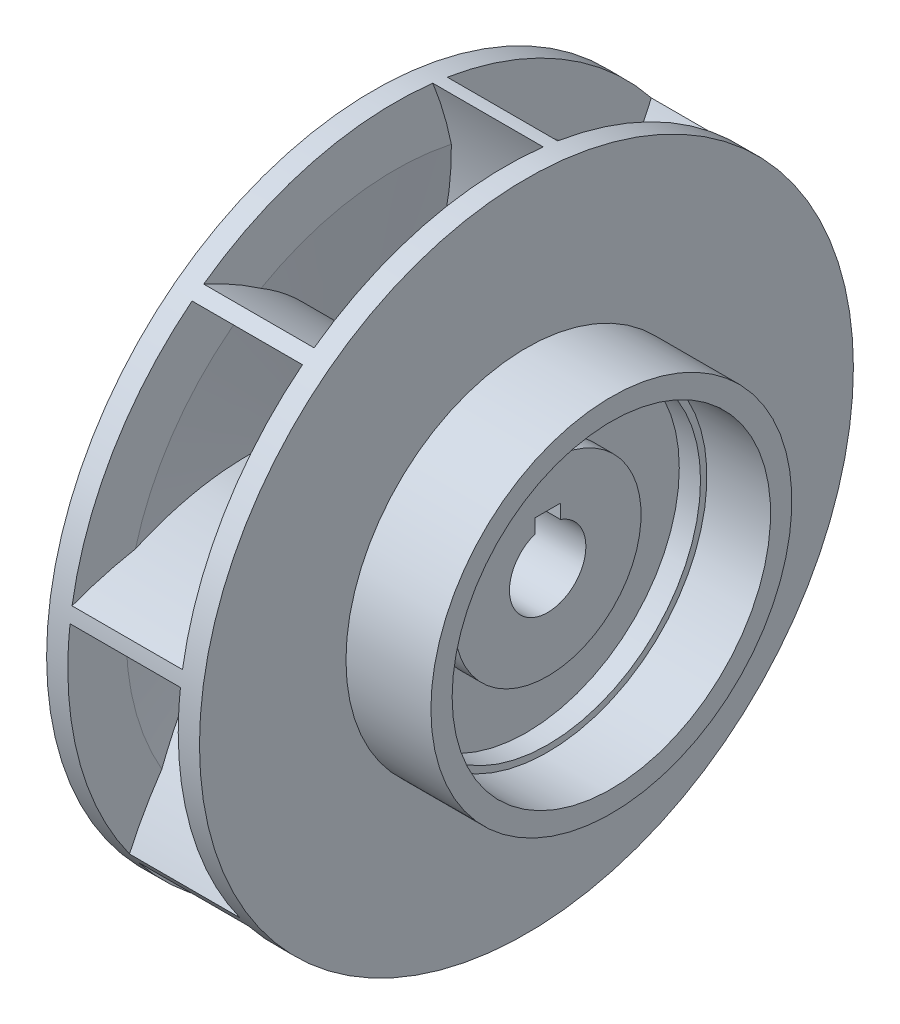
from build123d import *

# Parameters (mm, degrees)
BOSS_EXTRUDE1_START      = 34
BOSS_EXTRUDE1_DEPTH      = 34
FILLET2_R                = 5
CIRPATTERN1_COUNT        = 8
FILLET2_OF_CIRPATTERN1_R = 5
CUT_EXTRUDE1_DEPTH       = 119.604384405
CUT_EXTRUDE1_DEPTH_BACK  = 119.604384405
SKETCH5_W                = 6
SKETCH5_H                = 5.6


with BuildPart() as part:
    # Sketch1 → Revolve1 (revolve)
    with BuildSketch(Plane.XY, mode=Mode.PRIVATE) as revolve1_sk:
        with BuildLine():
            Line((0, 9), (32, 9))
            Line((32, 9), (32, 22))
            Line((32, 22), (27, 22))
            Line((27, 22), (27, 36))
            Line((27, 36), (32, 36))
            Line((32, 36), (32, 37.5))
            Line((32, 37.5), (47, 37.5))
            Line((47, 37.5), (47, 42.5))
            Line((47, 42.5), (27, 42.5))
            Line((27, 42.5), (27, 77))
            Line((27, 77), (22, 77))
            Line((22, 77), (22, 62.221142199))
            ThreePointArc((22, 62.221142199), (16.058772732, 41.244965236), (0, 26.5))
            Line((0, 26.5), (0, 9))
        make_face()
    revolve(revolve1_sk.sketch.rotate(Axis((-33.428571429, 0, 0), (1, 0, 0)), 90), axis=Axis((-33.428571429, 0, 0), (1, 0, 0)))

    # Sketch2 → Boss-Extrude1 (add)
    with BuildSketch(Plane.ZY.offset(-22).offset(BOSS_EXTRUDE1_START)):
        with BuildLine():
            ThreePointArc((16.177612088, 9.9641792), (15.303519911, 11.260651772), (14.325784401, 12.480861401))
            ThreePointArc((14.325784401, 12.480861401), (45.174878053, 17.999826237), (76.001792959, 12.358295474))
            ThreePointArc((76.001792959, 12.358295474), (76.258506863, 10.660212525), (76.477285886, 8.956826641))
            ThreePointArc((76.477285886, 8.956826641), (46.419792452, 14.988141463), (16.177612088, 9.9641792))
        make_face()
    boss_extrude1 = extrude(amount=-BOSS_EXTRUDE1_DEPTH)

    # Fillet2
    fillet2_edges = [part.edges().sort_by_distance(p)[0] for p in [
        (-12, 11.260651772, 15.303519911),
    ]]
    fillet(fillet2_edges, radius=FILLET2_R)

    # CirPattern1: Boss-Extrude1 ×8 about axis
    cirpattern1_axis = Axis((0, 0, 0), (1, 0, 0))
    for i in range(1, CIRPATTERN1_COUNT):
        add(boss_extrude1.rotate(cirpattern1_axis, i * 360 / CIRPATTERN1_COUNT))

    # Fillet2 of CirPattern1
    fillet2_of_cirpattern1_edges = [part.edges().sort_by_distance(p)[0] for p in [
        (-12, -2.858739477, 18.783705934),
        (-12, -15.303519911, 11.260651772),
        (-12, -18.783705934, -2.858739477),
        (-12, -11.260651772, -15.303519911),
        (-12, 2.858739477, -18.783705934),
        (-12, 15.303519911, -11.260651772),
        (-12, 18.783705934, 2.858739477),
    ]]
    fillet(fillet2_of_cirpattern1_edges, radius=FILLET2_OF_CIRPATTERN1_R)

    # Sketch3 → Revolve2 (revolve)
    with BuildSketch(Plane.XY, mode=Mode.PRIVATE) as revolve2_sk:
        Polygon((-10.467078689, 30), (-33, 30), (-33, 35), (-18, 35), (-18, 37), (-14.2, 37), (-9, 63.751680883), (-9, 77), (-4, 77), (-4, 63.270235642), align=None)
    revolve(revolve2_sk.sketch.rotate(Axis((-68.481988725, 0, 0), (1, 0, 0)), 90), axis=Axis((-68.481988725, 0, 0), (1, 0, 0)))

    # Sketch4 → Cut-Revolve1 (revolve, cut)
    with BuildSketch(Plane.XY, mode=Mode.PRIVATE) as cut_revolve1_sk:
        Polygon((-18, 37), (-14.2, 37), (-9, 63.751680883), (-9, 77), (-18, 77), align=None)
    revolve(cut_revolve1_sk.sketch.rotate(Axis((-70.543141996, 0, 0), (1, 0, 0)), 90), axis=Axis((-70.543141996, 0, 0), (1, 0, 0)), mode=Mode.SUBTRACT)

    # Sketch5 → Cut-Extrude1 (cut, two sides: drawn at the far end of the back side and taken through both)
    with BuildSketch(Plane(origin=(0, 0, 0), x_dir=(0, 0, -1), z_dir=(1, 0, 0)).offset(-CUT_EXTRUDE1_DEPTH_BACK)):
        with Locations((0, 9)):
            Rectangle(SKETCH5_W, SKETCH5_H)
    extrude(amount=CUT_EXTRUDE1_DEPTH + CUT_EXTRUDE1_DEPTH_BACK, mode=Mode.SUBTRACT)


solid = part.part
